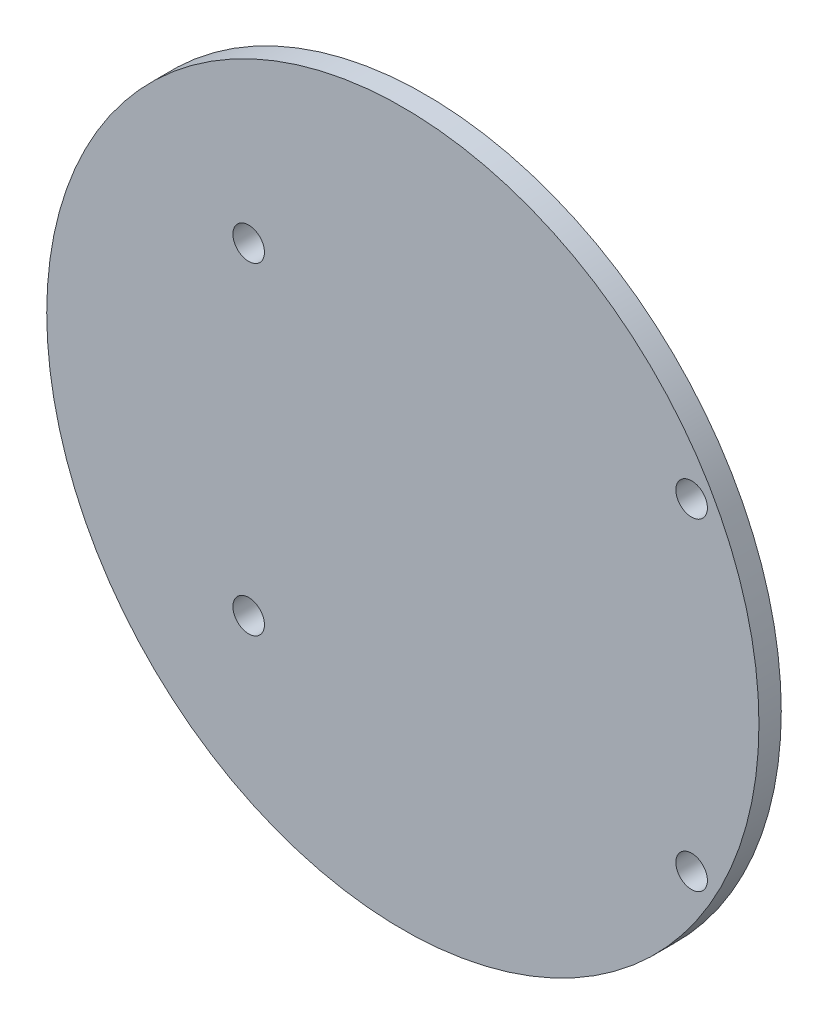
from build123d import *

# Parameters (mm, degrees)
SKETCH1_R              = 25.527
BOARD_DEPTH            = 1.6
SKETCH2_R              = 1.13
NON_PLATED_HOLES_DEPTH = 76.630682782


with BuildPart() as part:
    # Sketch1 → BOARD (new body)
    with BuildSketch(Plane.XY):
        with Locations((27.94, 27.94)):
            Circle(SKETCH1_R)
    extrude(amount=BOARD_DEPTH)

    # Sketch2 → NON-PLATED HOLES (cut, through all)
    with BuildSketch(Plane.XY):
        with Locations((48.64, 39.5)):
            Circle(SKETCH2_R)
        with Locations((48.64, 16.38)):
            Circle(SKETCH2_R)
        with Locations((16.89, 39.5)):
            Circle(SKETCH2_R)
        with Locations((16.89, 16.38)):
            Circle(SKETCH2_R)
    extrude(amount=NON_PLATED_HOLES_DEPTH, mode=Mode.SUBTRACT)


solid = part.part
